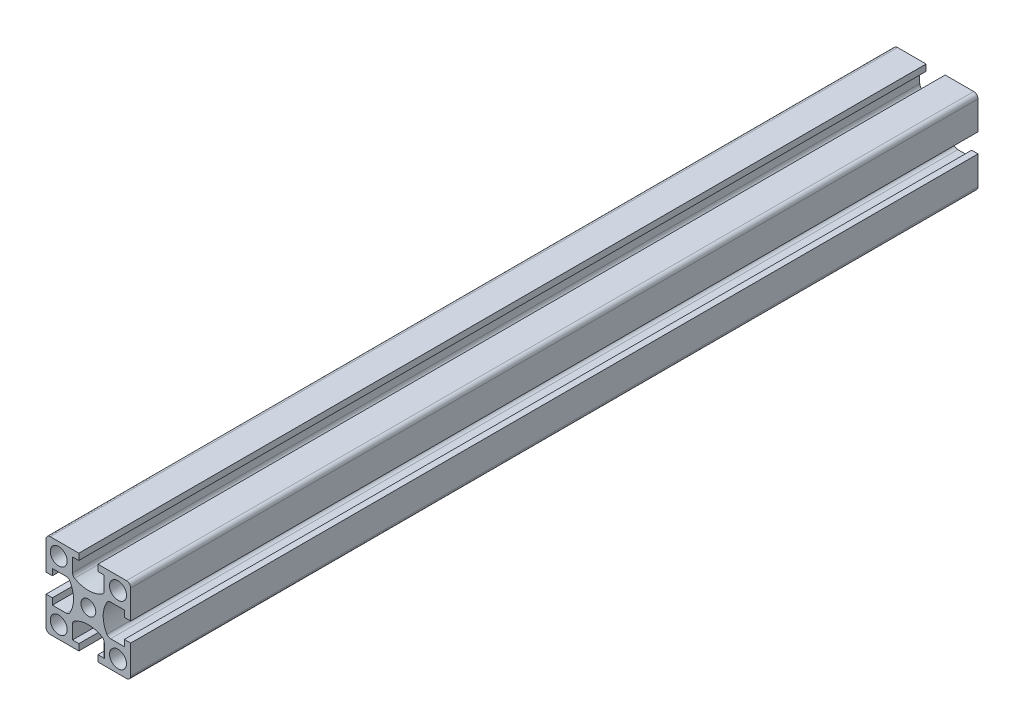
from build123d import *

# Parameters (mm, degrees)
SKETCH1_R           = 2.5
SKETCH1_R_2         = 2.1875
BOSS_EXTRUDE1_DEPTH = 250


with BuildPart() as part:
    # Sketch1 → Boss-Extrude1 (new body)
    with BuildSketch(Plane.XY):
        with BuildLine():
            Line((-12.5, 11.25), (-12.5, 2.8125))
            Line((-12.5, 2.8125), (-10.625, 2.8125))
            Line((-10.625, 2.8125), (-10.625, 4.6875))
            Line((-10.625, 4.6875), (-6.546075349, 4.6875))
            ThreePointArc((-6.546075349, 4.6875), (-5.921075349, 4.520031755), (-5.463543594, 4.0625))
            ThreePointArc((-5.463543594, 4.0625), (-4.375, 0), (-5.463543594, -4.0625))
            ThreePointArc((-5.463543594, -4.0625), (-5.921075349, -4.520031755), (-6.546075349, -4.6875))
            Line((-6.546075349, -4.6875), (-10.625, -4.6875))
            Line((-10.625, -4.6875), (-10.625, -2.8125))
            Line((-10.625, -2.8125), (-12.5, -2.8125))
            Line((-12.5, -2.8125), (-12.5, -11.25))
            ThreePointArc((-12.5, -11.25), (-12.133883476, -12.133883476), (-11.25, -12.5))
            Line((-11.25, -12.5), (-2.8125, -12.5))
            Line((-2.8125, -12.5), (-2.8125, -10.625))
            Line((-2.8125, -10.625), (-4.6875, -10.625))
            Line((-4.6875, -10.625), (-4.6875, -6.546075349))
            ThreePointArc((-4.6875, -6.546075349), (-4.520031755, -5.921075349), (-4.0625, -5.463543594))
            ThreePointArc((-4.0625, -5.463543594), (0, -4.375), (4.0625, -5.463543594))
            ThreePointArc((4.0625, -5.463543594), (4.520031755, -5.921075349), (4.6875, -6.546075349))
            Line((4.6875, -6.546075349), (4.6875, -10.625))
            Line((4.6875, -10.625), (2.8125, -10.625))
            Line((2.8125, -10.625), (2.8125, -12.5))
            Line((2.8125, -12.5), (11.25, -12.5))
            ThreePointArc((11.25, -12.5), (12.133883476, -12.133883476), (12.5, -11.25))
            Line((12.5, -11.25), (12.5, -2.8125))
            Line((12.5, -2.8125), (10.625, -2.8125))
            Line((10.625, -2.8125), (10.625, -4.6875))
            Line((10.625, -4.6875), (6.546075349, -4.6875))
            ThreePointArc((6.546075349, -4.6875), (5.921075349, -4.520031755), (5.463543594, -4.0625))
            ThreePointArc((5.463543594, -4.0625), (4.375, 0), (5.463543594, 4.0625))
            ThreePointArc((5.463543594, 4.0625), (5.921075349, 4.520031755), (6.546075349, 4.6875))
            Line((6.546075349, 4.6875), (10.625, 4.6875))
            Line((10.625, 4.6875), (10.625, 2.8125))
            Line((10.625, 2.8125), (12.5, 2.8125))
            Line((12.5, 2.8125), (12.5, 11.25))
            ThreePointArc((12.5, 11.25), (12.133883476, 12.133883476), (11.25, 12.5))
            Line((11.25, 12.5), (2.8125, 12.5))
            Line((2.8125, 12.5), (2.8125, 10.625))
            Line((2.8125, 10.625), (4.6875, 10.625))
            Line((4.6875, 10.625), (4.6875, 6.546075349))
            ThreePointArc((4.6875, 6.546075349), (4.520031755, 5.921075349), (4.0625, 5.463543594))
            ThreePointArc((4.0625, 5.463543594), (0, 4.375), (-4.0625, 5.463543594))
            ThreePointArc((-4.0625, 5.463543594), (-4.520031755, 5.921075349), (-4.6875, 6.546075349))
            Line((-4.6875, 6.546075349), (-4.6875, 10.625))
            Line((-4.6875, 10.625), (-2.8125, 10.625))
            Line((-2.8125, 10.625), (-2.8125, 12.5))
            Line((-2.8125, 12.5), (-11.25, 12.5))
            ThreePointArc((-11.25, 12.5), (-12.133883476, 12.133883476), (-12.5, 11.25))
        make_face()
        with Locations((-8.75, -8.75)):
            Circle(SKETCH1_R, mode=Mode.SUBTRACT)
        with Locations((8.75, -8.75)):
            Circle(SKETCH1_R, mode=Mode.SUBTRACT)
        with Locations((8.75, 8.75)):
            Circle(SKETCH1_R, mode=Mode.SUBTRACT)
        Circle(SKETCH1_R_2, mode=Mode.SUBTRACT)
        with Locations((-8.75, 8.75)):
            Circle(SKETCH1_R, mode=Mode.SUBTRACT)
    extrude(amount=BOSS_EXTRUDE1_DEPTH)


solid = part.part
